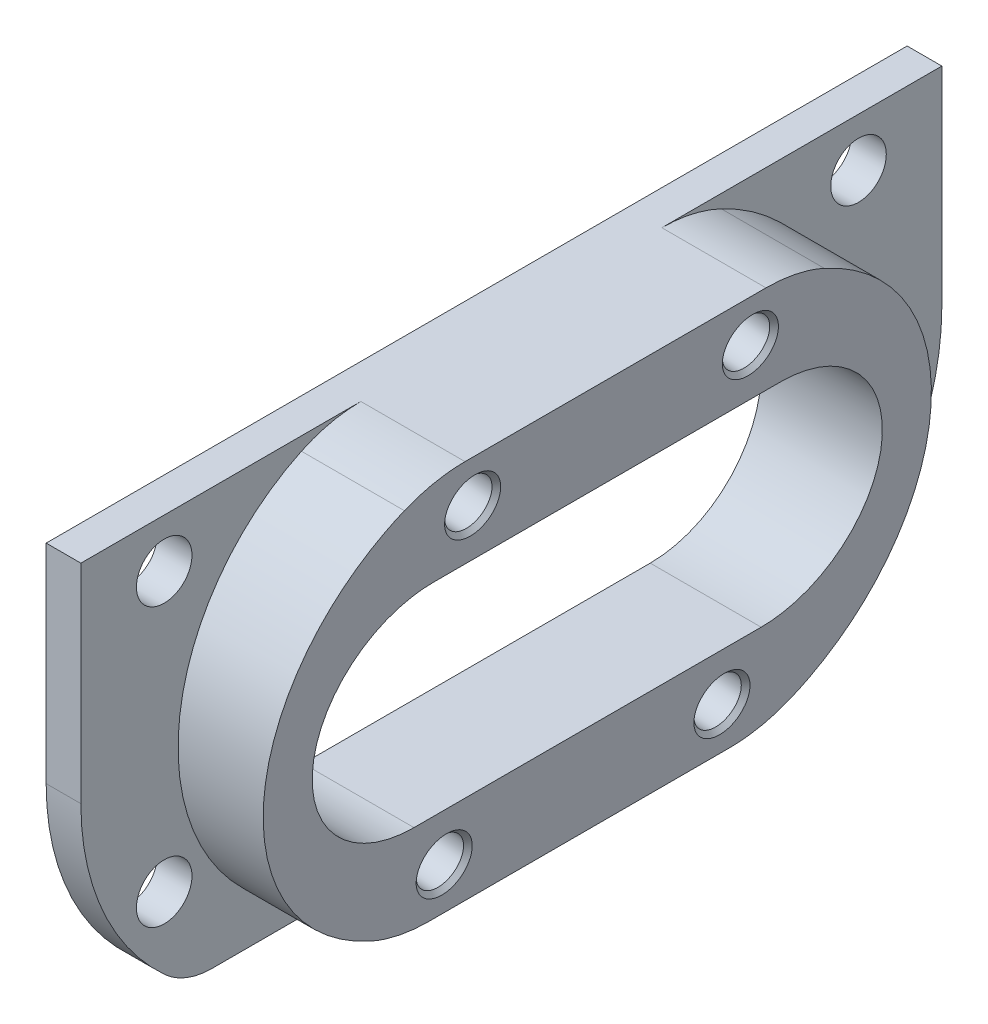
from build123d import *

# Parameters (mm, degrees)
SZKIC1_R                                   = 4
DODANIE_WYCI_GNI_CIE1_DEPTH                = 20
SZKIC2_OUTSIDE_W                           = 153.84
SZKIC2_OUTSIDE_H                           = 89.84
WYTNIJ_WYCI_GNI_CIE1_DEPTH                 = 15
WYTNIJ_WYCI_GNI_CIE2_DEPTH                 = 130.135587659
WYTNIJ_WYCI_GNI_CIE2_DEPTH_BACK            = 130.135587659
OTW_R_GWINTOWANY_M81_D                     = 6.8
OTW_R_GWINTOWANY_M81_DEPTH                 = 12.957073895
OTW_R_GWINTOWANY_M81_CSINK_D               = 8.05
OTW_R_GWINTOWANY_M81_CSINK_ANGLE           = 90
OTW_R_GWINTOWANY_M81_TIP                   = 2.042926105
OTW_R_GWINTOWANY_M81_ON_FACE_2_D           = 6.8
OTW_R_GWINTOWANY_M81_ON_FACE_2_DEPTH       = 12.957073895
OTW_R_GWINTOWANY_M81_ON_FACE_2_CSINK_D     = 8.05
OTW_R_GWINTOWANY_M81_ON_FACE_2_CSINK_ANGLE = 90
OTW_R_GWINTOWANY_M81_ON_FACE_2_TIP         = 2.042926105


with BuildPart() as part:
    # Szkic1 → Dodanie-wyciągnięcie1 (new body)
    with BuildSketch(Plane(origin=(0, 0, 0), x_dir=(0, 0, -1), z_dir=(1, 0, 0))):
        with BuildLine():
            Line((-43.138357147, -30), (43.138357147, -30))
            ThreePointArc((43.138357147, -30), (46.738768646, -29.329364235), (49.856267202, -27.407407407))
            ThreePointArc((49.856267202, -27.407407407), (58.828108774, -14.988630917), (62, 0))
            Line((62, 0), (62, 30))
            Line((62, 30), (-62, 30))
            Line((-62, 30), (-62, 0))
            ThreePointArc((-62, 0), (-58.828108774, -14.988630917), (-49.856267202, -27.407407407))
            ThreePointArc((-49.856267202, -27.407407407), (-46.738768646, -29.329364235), (-43.138357147, -30))
        make_face()
        with Locations((-50, 23)):
            Circle(SZKIC1_R, mode=Mode.SUBTRACT)
        with Locations((50, 23)):
            Circle(SZKIC1_R, mode=Mode.SUBTRACT)
        with Locations((50, -17)):
            Circle(SZKIC1_R, mode=Mode.SUBTRACT)
        with Locations((-50, -17)):
            Circle(SZKIC1_R, mode=Mode.SUBTRACT)
        with BuildLine():
            Line((-25, -16), (25, -16))
            ThreePointArc((25, -16), (41, 0), (25, 16))
            Line((25, 16), (-25, 16))
            ThreePointArc((-25, 16), (-41, 0), (-25, -16))
        make_face(mode=Mode.SUBTRACT)
    extrude(amount=DODANIE_WYCI_GNI_CIE1_DEPTH)

    # Szkic2 outside → Wytnij-wyciągnięcie1 (cut)
    # profile 1 of 2: a face of its own
    with BuildSketch(Plane(origin=(20, 0, 0), x_dir=(0, 0, -1), z_dir=(1, 0, 0))):
        Rectangle(SZKIC2_OUTSIDE_W, SZKIC2_OUTSIDE_H)
        with BuildLine():
            Line((21.671768561, 30), (-21.671768561, 30))
            ThreePointArc((-21.671768561, 30), (-26.059642547, 29.512728202), (-30.233707808, 28.074656189))
            ThreePointArc((-30.233707808, 28.074656189), (-48, 0), (-30.233707808, -28.074656189))
            ThreePointArc((-30.233707808, -28.074656189), (-26.059642547, -29.512728202), (-21.671768561, -30))
            Line((-21.671768561, -30), (21.671768561, -30))
            ThreePointArc((21.671768561, -30), (26.059642547, -29.512728202), (30.233707808, -28.074656189))
            ThreePointArc((30.233707808, -28.074656189), (48, 0), (30.233707808, 28.074656189))
            ThreePointArc((30.233707808, 28.074656189), (26.059642547, 29.512728202), (21.671768561, 30))
        make_face(mode=Mode.SUBTRACT)
    # profile 2 of 2: a face of its own
    with BuildSketch(Plane(origin=(20, 0, 0), x_dir=(0, 0, -1), z_dir=(1, 0, 0))):
        with BuildLine():
            Line((-25, -16), (25, -16))
            ThreePointArc((25, -16), (41, 0), (25, 16))
            Line((25, 16), (-25, 16))
            ThreePointArc((-25, 16), (-41, 0), (-25, -16))
        make_face()
    extrude(amount=-WYTNIJ_WYCI_GNI_CIE1_DEPTH, mode=Mode.SUBTRACT)

    # Szkic3 → Wytnij-wyciągnięcie2 (cut, two sides: drawn at the far end of the back side and taken through both)
    with BuildSketch(Plane(origin=(0, 0, -62), x_dir=(-1, 0, 0), z_dir=(0, 0, -1)).offset(-WYTNIJ_WYCI_GNI_CIE2_DEPTH_BACK)):
        Polygon((-20, 30), (-14.750680188, -30), (-20, -30), align=None)
    extrude(amount=WYTNIJ_WYCI_GNI_CIE2_DEPTH + WYTNIJ_WYCI_GNI_CIE2_DEPTH_BACK, mode=Mode.SUBTRACT)

    # Otwór gwintowany M81
    with Locations(Plane(origin=(19.423500049, 23.410575405, 20), x_dir=(0.087155742748, 0.996194698092, 0), z_dir=(0.996194698092, -0.087155742748, 0))):
        with Locations((0, 0), (0, -40)):
            CounterSinkHole(OTW_R_GWINTOWANY_M81_D / 2, OTW_R_GWINTOWANY_M81_CSINK_D / 2, depth=OTW_R_GWINTOWANY_M81_DEPTH, counter_sink_angle=OTW_R_GWINTOWANY_M81_CSINK_ANGLE)
            with Locations((0, 0, -(OTW_R_GWINTOWANY_M81_DEPTH + OTW_R_GWINTOWANY_M81_TIP / 2))):  # 118° drill point
                Cone(0, OTW_R_GWINTOWANY_M81_D / 2, OTW_R_GWINTOWANY_M81_TIP, mode=Mode.SUBTRACT)

    # Otwór gwintowany M81 on face 2
    with Locations(Plane(origin=(15.32718014, -23.410575405, -20), x_dir=(0.087155971833, 0.996194678049, 0), z_dir=(0.996194678049, -0.087155971833, 0))):
        with Locations((0, 0), (0, 40)):
            CounterSinkHole(OTW_R_GWINTOWANY_M81_ON_FACE_2_D / 2, OTW_R_GWINTOWANY_M81_ON_FACE_2_CSINK_D / 2, depth=OTW_R_GWINTOWANY_M81_ON_FACE_2_DEPTH, counter_sink_angle=OTW_R_GWINTOWANY_M81_ON_FACE_2_CSINK_ANGLE)
            with Locations((0, 0, -(OTW_R_GWINTOWANY_M81_ON_FACE_2_DEPTH + OTW_R_GWINTOWANY_M81_ON_FACE_2_TIP / 2))):  # 118° drill point
                Cone(0, OTW_R_GWINTOWANY_M81_ON_FACE_2_D / 2, OTW_R_GWINTOWANY_M81_ON_FACE_2_TIP, mode=Mode.SUBTRACT)


solid = part.part
